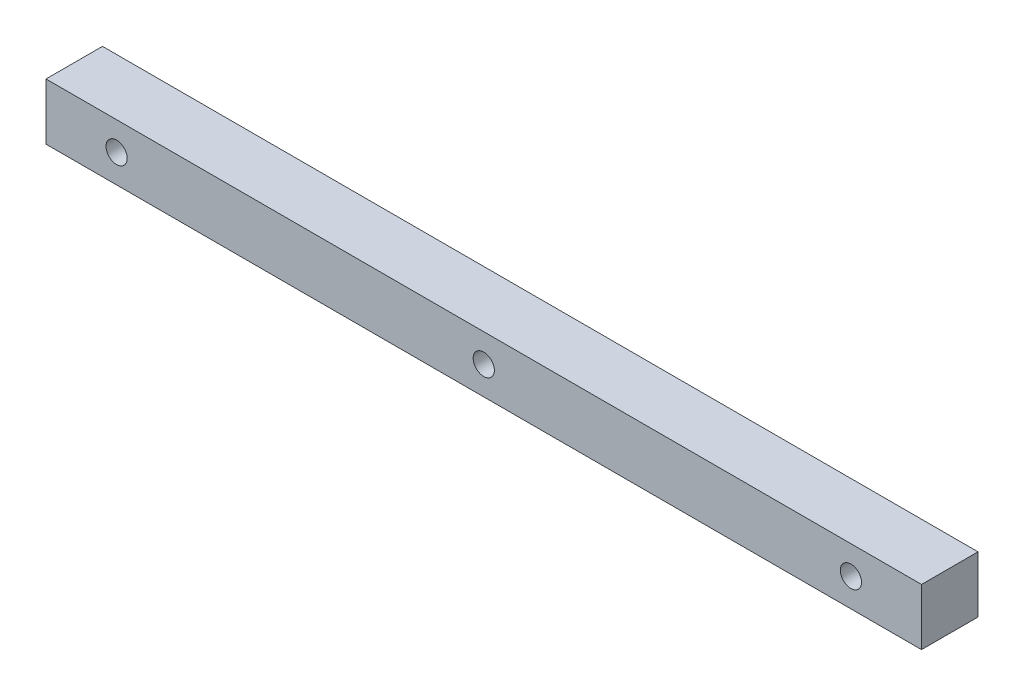
from build123d import *

# Parameters (mm, degrees)
SKETCH_1_W      = 124
SKETCH_1_H      = 8
SKETCH_1_R      = 1.5
EXTRUDE_1_DEPTH = 8


with BuildPart() as part:
    # 草图1 → 凸台-拉伸1 (new body)
    with BuildSketch(Plane.XY):
        with Locations((62, 4)):
            Rectangle(SKETCH_1_W, SKETCH_1_H)
        with Locations((62, 4)):
            Circle(SKETCH_1_R, mode=Mode.SUBTRACT)
        with Locations((10, 4)):
            Circle(SKETCH_1_R, mode=Mode.SUBTRACT)
        with Locations(Location((114, 4, 0), (0, 0, 180))):
            Circle(SKETCH_1_R, mode=Mode.SUBTRACT)
    extrude(amount=EXTRUDE_1_DEPTH)


solid = part.part
